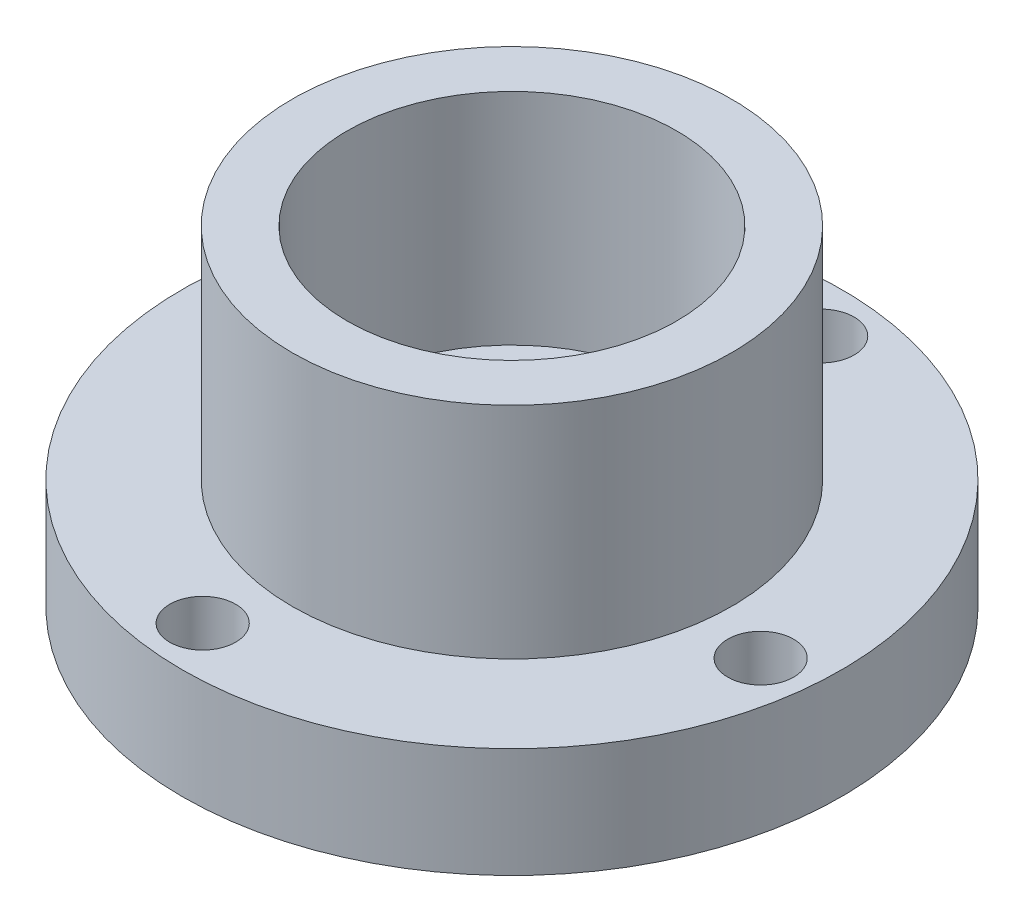
from build123d import *

# Parameters (mm, degrees)
SKETCH1_R           = 15
SKETCH1_R_2         = 1.5
BOSS_EXTRUDE1_DEPTH = 5
SKETCH2_R           = 10
SKETCH2_R_2         = 7.5
BOSS_EXTRUDE2_DEPTH = 10


with BuildPart() as part:
    # Sketch1 → Boss-Extrude1 (new body)
    with BuildSketch(Plane(origin=(0, 0, 0), x_dir=(1, 0, 0), z_dir=(0, 1, 0))):
        with Locations(Location((0, 0, 0), (0, 0, 270))):
            Circle(SKETCH1_R)
        with Locations(Location((-12.697691575, 1.377182715, 0), (0, 0, 270))):
            Circle(SKETCH1_R_2, mode=Mode.SUBTRACT)
        with Locations(Location((1.377182715, 12.697691575, 0), (0, 0, 270))):
            Circle(SKETCH1_R_2, mode=Mode.SUBTRACT)
        with Locations(Location((12.697691575, -1.377182715, 0), (0, 0, 270))):
            Circle(SKETCH1_R_2, mode=Mode.SUBTRACT)
        with Locations(Location((-1.377182715, -12.697691575, 0), (0, 0, 270))):
            Circle(SKETCH1_R_2, mode=Mode.SUBTRACT)
    extrude(amount=BOSS_EXTRUDE1_DEPTH)

    # Sketch2 → Boss-Extrude2 (add)
    with BuildSketch(Plane(origin=(0, 5, 0), x_dir=(1, 0, 0), z_dir=(0, 1, 0))):
        with Locations(Location((0, 0, 0), (0, 0, 270))):
            Circle(SKETCH2_R)
        with Locations(Location((0, 0, 0), (0, 0, 270))):
            Circle(SKETCH2_R_2, mode=Mode.SUBTRACT)
    extrude(amount=BOSS_EXTRUDE2_DEPTH)


solid = part.part
